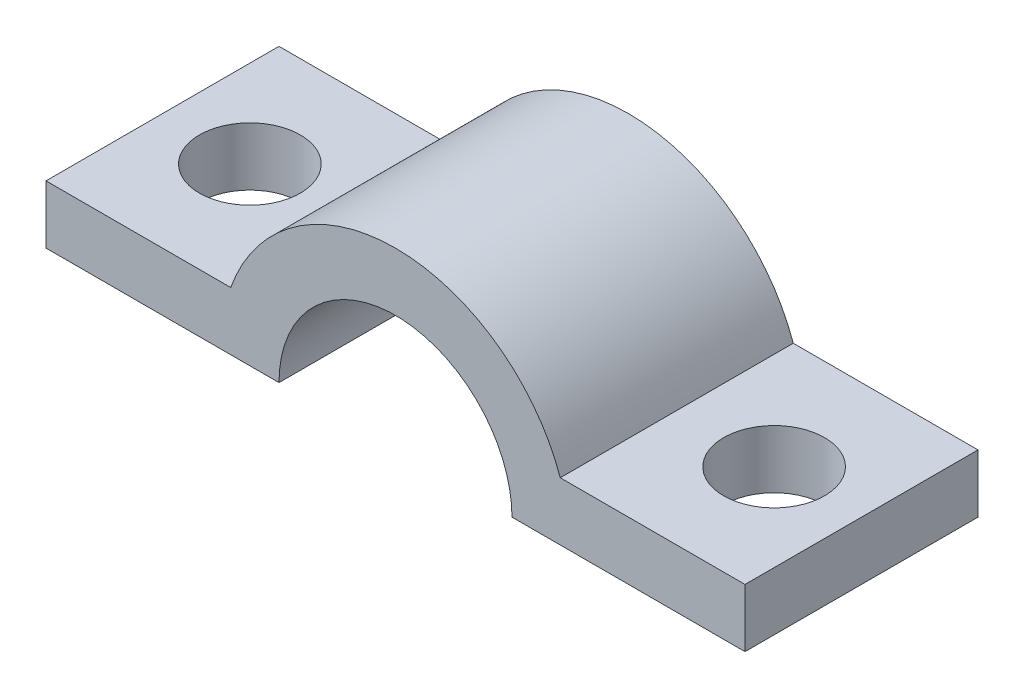
from build123d import *

# Parameters (mm, degrees)
BOSS_EXTRUDE1_DEPTH  = 12.7
M5_CLEARANCE_HOLE2_D = 5.5


with BuildPart() as part:
    # Sketch1 → Boss-Extrude1 (new body)
    with BuildSketch(Plane.XY):
        with BuildLine():
            Line((25.4, 0), (38.1, 0))
            Line((38.1, 0), (38.1, 3.175))
            Line((38.1, 3.175), (28.030256121, 3.175))
            ThreePointArc((28.030256121, 3.175), (19.05, 9.525), (10.069743879, 3.175))
            Line((10.069743879, 3.175), (0, 3.175))
            Line((0, 3.175), (0, 0))
            Line((0, 0), (12.7, 0))
            ThreePointArc((12.7, 0), (19.05, 6.35), (25.4, 0))
        make_face()
    extrude(amount=BOSS_EXTRUDE1_DEPTH)

    # M5 Clearance Hole2 (through all)
    with Locations(Plane(origin=(0, 3.175, 0), x_dir=(1, 0, 0), z_dir=(0, 1, 0))):
        with Locations((4.7625, -6.35), (33.3375, -6.35)):
            Hole(M5_CLEARANCE_HOLE2_D / 2)


solid = part.part
